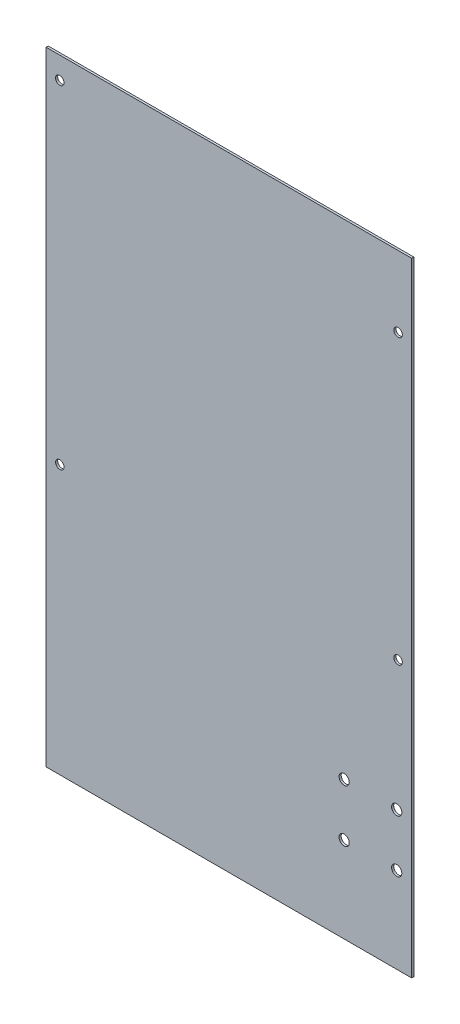
from build123d import *

# Parameters (mm, degrees)
CROQUIS1_W              = 170.18
CROQUIS1_H              = 290.18
SALIENTE_EXTRUIR1_DEPTH = 1
CROQUIS2_R              = 1.975
CORTAR_EXTRUIR1_DEPTH   = 1
CROQUIS3_R              = 2.38
CORTAR_EXTRUIR2_DEPTH   = 10


with BuildPart() as part:
    # Croquis1 → Saliente-Extruir1 (new body)
    with BuildSketch(Plane.XY):
        Rectangle(CROQUIS1_W, CROQUIS1_H)
    extrude(amount=SALIENTE_EXTRUIR1_DEPTH)

    # Croquis2 → Cortar-Extruir1 (cut)
    with BuildSketch(Plane(origin=(0, 0, 0), x_dir=(-1, 0, 0), z_dir=(0, 0, -1))):
        with Locations(Location((-78.74, 112.07, 0), (0, 0, 180))):
            Circle(CROQUIS2_R)
        with Locations((78.74, 134.91)):
            Circle(CROQUIS2_R)
        with Locations((78.74, -20.01)):
            Circle(CROQUIS2_R)
        with Locations(Location((-78.74, -20.01, 0), (0, 0, 180))):
            Circle(CROQUIS2_R)
    extrude(amount=-CORTAR_EXTRUIR1_DEPTH, mode=Mode.SUBTRACT)

    # Croquis3 → Cortar-Extruir2 (cut)
    with BuildSketch(Plane(origin=(0, 0, 0), x_dir=(-1, 0, 0), z_dir=(0, 0, -1))):
        with Locations(Location((-78.11, -105.2, 0), (0, 0, 180))):
            Circle(CROQUIS3_R)
        with Locations(Location((-53.64, -105.2, 0), (0, 0, 180))):
            Circle(CROQUIS3_R)
        with Locations(Location((-53.64, -80.73, 0), (0, 0, 180))):
            Circle(CROQUIS3_R)
        with Locations(Location((-78.11, -80.73, 0), (0, 0, 180))):
            Circle(CROQUIS3_R)
    extrude(amount=-CORTAR_EXTRUIR2_DEPTH, mode=Mode.SUBTRACT)


solid = part.part
